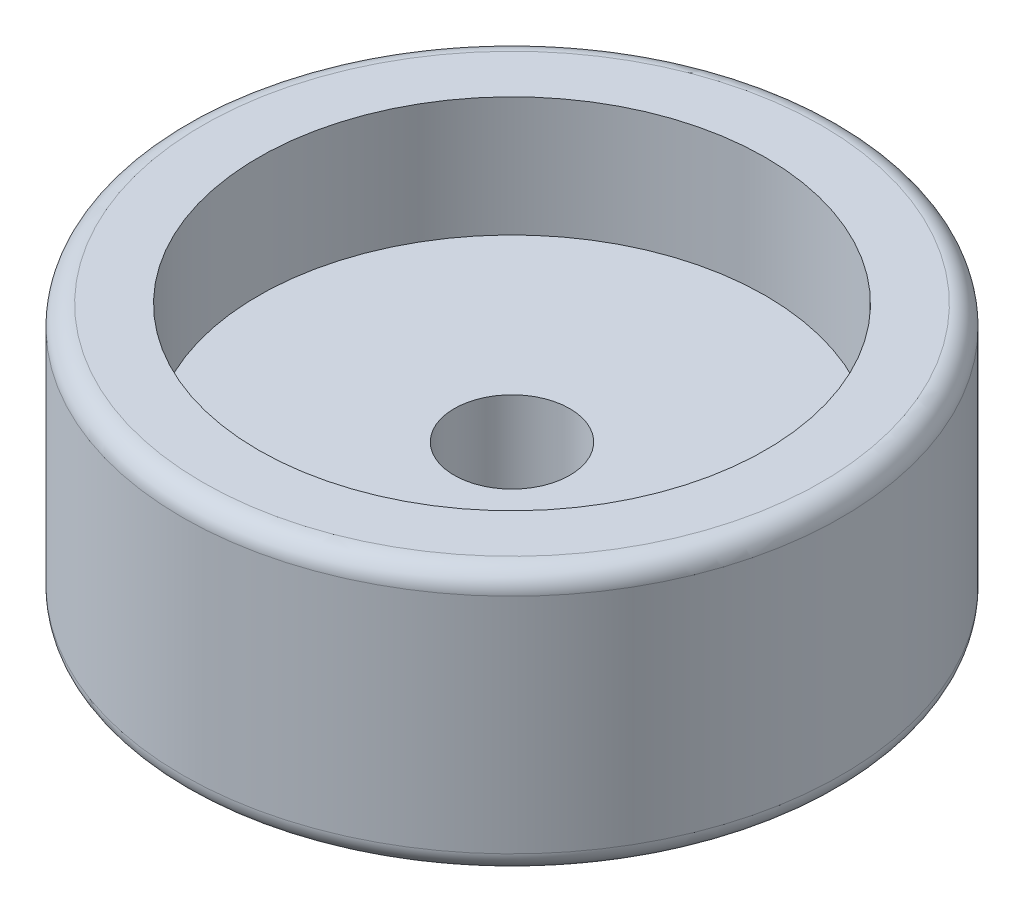
from build123d import *

# Parameters (mm, degrees)
SKETCH_1_R          = 32.5
SKETCH_1_R_2        = 5.7
EXTRUDE_1_DEPTH     = 26
SKETCH_2_R          = 25
CUT_EXTRUDE_1_DEPTH = 11.8
FILLET_1_R          = 2


with BuildPart() as part:
    # 草图1 → 凸台-拉伸1 (new body)
    with BuildSketch(Plane(origin=(0, 0, 0), x_dir=(1, 0, 0), z_dir=(0, 1, 0))):
        with Locations(Location((0, 0, 0), (0, 0, 90))):
            Circle(SKETCH_1_R)
        with Locations(Location((0, 0, 0), (0, 0, 90))):
            Circle(SKETCH_1_R_2, mode=Mode.SUBTRACT)
    extrude(amount=EXTRUDE_1_DEPTH)

    # 草图2 → 切除-拉伸1 (cut)
    with BuildSketch(Plane(origin=(0, 26, 0), x_dir=(1, 0, 0), z_dir=(0, 1, 0))):
        with Locations(Location((0, 0, 0), (0, 0, 270))):
            Circle(SKETCH_2_R)
    extrude(amount=-CUT_EXTRUDE_1_DEPTH, mode=Mode.SUBTRACT)

    # 圆角1
    fillet_1_edges = [part.edges().sort_by_distance(p)[0] for p in [
        (0, 0, 32.5),
        (0, 26, 32.5),
    ]]
    fillet(fillet_1_edges, radius=FILLET_1_R)


solid = part.part
